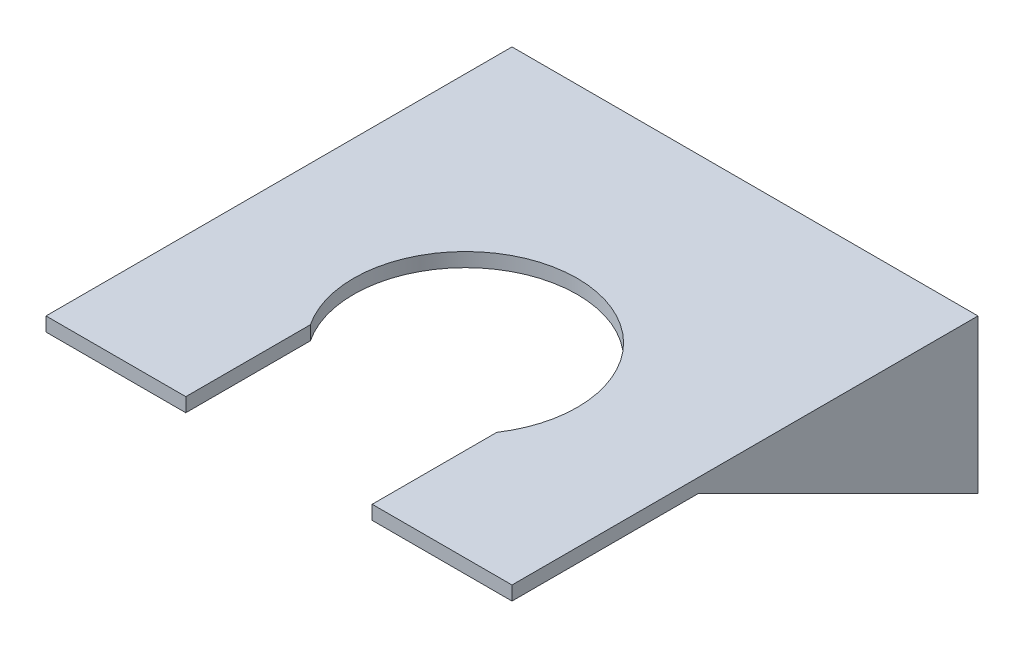
from build123d import *

# Parameters (mm, degrees)
SKETCH1_W           = 50
SKETCH1_H           = 1.5
BOSS_EXTRUDE1_DEPTH = 50
CUT_EXTRUDE1_DEPTH  = 1.5
BOSS_EXTRUDE2_DEPTH = 1.5


with BuildPart() as part:
    # Sketch1 → Boss-Extrude1 (new body)
    with BuildSketch(Plane.XY):
        with Locations((0, -1.811768481)):
            Rectangle(SKETCH1_W, SKETCH1_H)
    extrude(amount=BOSS_EXTRUDE1_DEPTH)

    # Sketch2 → Cut-Extrude1 (cut)
    with BuildSketch(Plane(origin=(0, -1.061768481, 0), x_dir=(1, 0, 0), z_dir=(0, 1, 0))):
        with BuildLine():
            Line((-10, -36.633249581), (-10, -50))
            Line((-10, -50), (10, -50))
            Line((10, -50), (10, -36.633249581))
            ThreePointArc((10, -36.633249581), (0, -18), (-10, -36.633249581))
        make_face()
    extrude(amount=-CUT_EXTRUDE1_DEPTH, mode=Mode.SUBTRACT)

    # Sketch4 → Boss-Extrude2 (add)
    with BuildSketch(Plane.ZY.offset(25)):
        Polygon((0, -2.561768481), (0, -17.561768481), (30, -2.561768481), align=None)
    boss_extrude2 = extrude(amount=-BOSS_EXTRUDE2_DEPTH)

    # Mirror1: Boss-Extrude2 across plane
    add(boss_extrude2.mirror(Plane(origin=(0, 0, 0), x_dir=(0, 0, 1), z_dir=(1, 0, 0))))


solid = part.part
